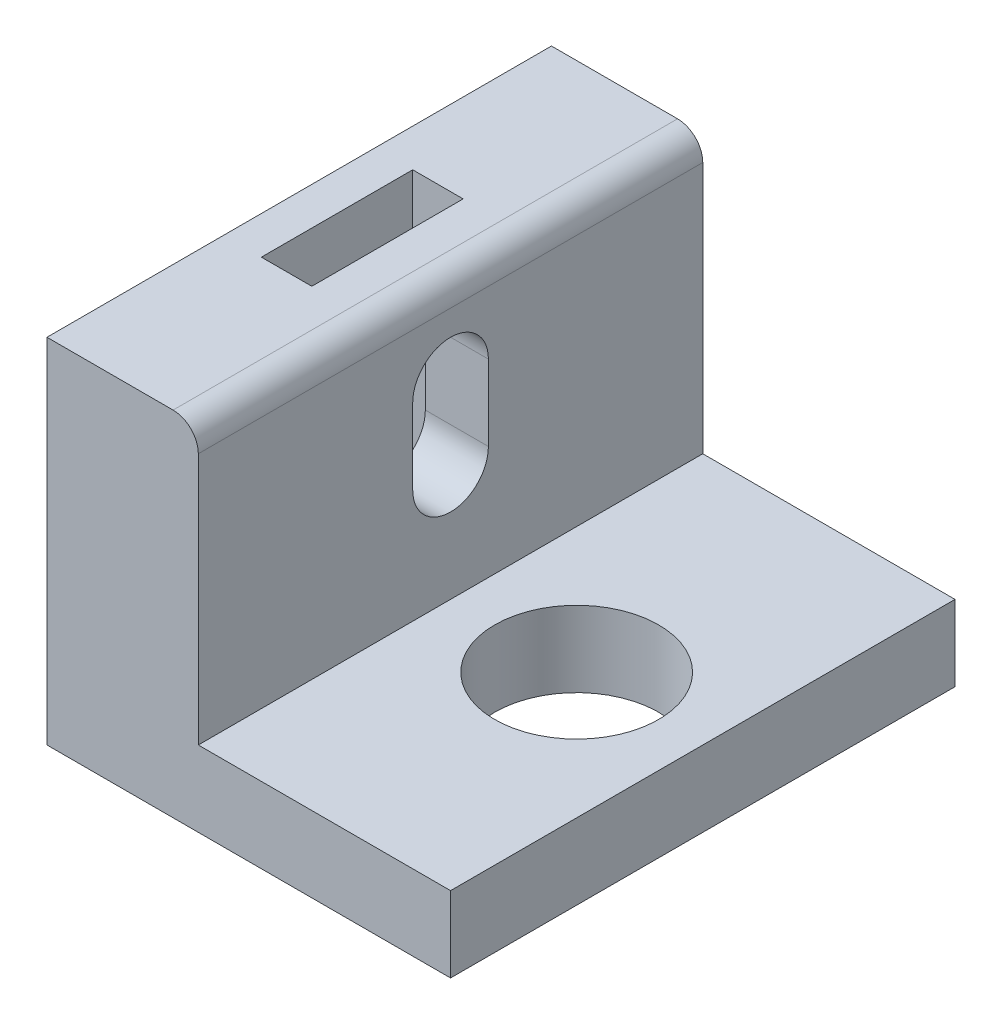
from build123d import *

# Parameters (mm, degrees)
ESTRUSIONE_ESTRUSIONE1_DEPTH         = 20
TAGLIO_ESTRUSIONE1_REACH             = 37.979
ESTRUSIONE_ESTRUSIONE4_DEPTH         = 0.6
SCHIZZO12_W                          = 2
SCHIZZO12_H                          = 6
TAGLIO_ESTRUSIONE2_DEPTH             = 11
SCHIZZO13_R                          = 3.25
TAGLIO_ESTRUSIONE3_DEPTH             = 27.487921942
TAGLIO_ESTRUSIONE4_REACH             = 34.76
SCHIZZO14_W                          = 18.5
SCHIZZO14_H                          = 9.5
TAGLIO_ESTRUSIONE4_DIRECTION_2_REACH = 34.76
SCHIZZO15_W                          = 1
SCHIZZO15_H                          = 20
ESTRUSIONE_ESTRUSIONE5_DEPTH         = 3


with BuildPart() as part:
    # Schizzo2 → Estrusione-Estrusione1 (new body)
    with BuildSketch(Plane.XY):
        with BuildLine():
            Line((-4, 9.5), (-11, 9.5))
            Line((-11, 9.5), (-11, 23.5))
            Line((-11, 23.5), (-6, 23.5))
            ThreePointArc((-6, 23.5), (-5.292893219, 23.207106781), (-5, 22.5))
            Line((-5, 22.5), (-5, 12.5))
            Line((-5, 12.5), (4, 12.5))
            Line((4, 12.5), (4, 9.5))
            Line((4, 9.5), (4, 6.5))
            Line((4, 6.5), (7.5, 6.5))
            Line((7.5, 6.5), (7.5, 4))
            Line((7.5, 4), (4, 0))
            Line((4, 0), (-4, 0))
            Line((-4, 0), (-7.5, 4))
            Line((-7.5, 4), (-7.5, 6.5))
            Line((-7.5, 6.5), (-4, 6.5))
            Line((-4, 6.5), (-4, 9.5))
        make_face()
    extrude(amount=-ESTRUSIONE_ESTRUSIONE1_DEPTH)

    # Schizzo6 → Taglio-Estrusione1 (cut, up to next)
    with BuildSketch(Plane.ZY.offset(11), mode=Mode.PRIVATE) as taglio_estrusione1_sk1:
        with BuildLine():
            Line((-8.5, 20), (-8.5, 17))
            ThreePointArc((-8.5, 17), (-10, 15.5), (-11.5, 17))
            Line((-11.5, 17), (-11.5, 20))
            ThreePointArc((-11.5, 20), (-10, 21.5), (-8.5, 20))
        make_face()
    taglio_estrusione1_tool1 = extrude(taglio_estrusione1_sk1.sketch, amount=-TAGLIO_ESTRUSIONE1_REACH, mode=Mode.PRIVATE) & part.part
    add(taglio_estrusione1_tool1.solids().sort_by_distance((-11, 18.5, -10))[0], mode=Mode.SUBTRACT)

    # Schizzo11 → Estrusione-Estrusione4 (add)
    with BuildSketch(Plane(origin=(0, 0, -20), x_dir=(-1, 0, 0), z_dir=(0, 0, -1))):
        with BuildLine():
            Line((-1.916666667, 6), (-2.5, 6))
            add(Edge.make_bspline(
                [(-2.5, 6), (-2.484196549, 6.065431756), (-2.453302094, 6.193345487), (-2.388863743, 6.376101829), (-2.318665127, 6.549045511), (-2.234371075, 6.708938219), (-2.142426246, 6.858993324), (-2.037084049, 6.995807413), (-1.923204564, 7.122860063), (-1.797243944, 7.235613218), (-1.665147858, 7.337714716), (-1.525054993, 7.424768393), (-1.379783905, 7.499656106), (-1.228328086, 7.561350822), (-1.070236625, 7.607826795), (-0.906938753, 7.641546577), (-0.738006538, 7.66344436), (-0.623332441, 7.665581492), (-0.565104167, 7.666666667)],
                knots=[0, 0, 0, 0, 1.162005537, 2.271625781, 3.343758855, 4.383309926, 5.390229558, 6.379919256, 7.361854164, 8.333198761, 9.295911338, 10.242430842, 11.177959212, 12.116337295, 13.062827104, 14.020064771, 14.994644689, 16, 16, 16, 16], degree=3))
            add(Edge.make_bspline(
                [(-0.565104167, 7.666666667), (-0.480264789, 7.664105239), (-0.312436625, 7.659038256), (-0.065876681, 7.612768588), (0.171887412, 7.539550485), (0.398253158, 7.438384992), (0.608515961, 7.313608553), (0.795597451, 7.165102613), (0.956961828, 6.995732482), (1.092337101, 6.80865772), (1.198333527, 6.608726059), (1.276493935, 6.402954339), (1.324077057, 6.191830678), (1.330243806, 6.049281445), (1.333333333, 5.977864583)],
                knots=[0, 0, 0, 0, 1.083050992, 2.142477498, 3.193116406, 4.255571735, 5.30263384, 6.308962982, 7.297363603, 8.282367274, 9.249857812, 10.179914175, 11.08814088, 12, 12, 12, 12], degree=3))
            add(Edge.make_bspline(
                [(1.333333333, 5.977864583), (1.331172379, 5.909137679), (1.326943725, 5.774649792), (1.291038272, 5.578309869), (1.230613784, 5.393261183), (1.146912796, 5.218724739), (1.038564203, 5.055807179), (0.907314909, 4.904141953), (0.752238537, 4.763056374), (0.634720509, 4.682234495), (0.57421875, 4.640625)],
                knots=[0, 0, 0, 0, 1.024540389, 2.004866551, 2.965041327, 3.920577974, 4.882998113, 5.874504559, 6.905732034, 8, 8, 8, 8], degree=3))
            add(Edge.make_bspline(
                [(0.57421875, 4.640625), (0.643363437, 4.607236967), (0.780359061, 4.541085617), (0.967095758, 4.411353496), (1.136611813, 4.261563137), (1.231147291, 4.144669639), (1.278645833, 4.0859375)],
                knots=[0, 0, 0, 0, 1.015518401, 2.012035669, 3.001164323, 4, 4, 4, 4], degree=3))
            add(Edge.make_bspline(
                [(1.278645833, 4.0859375), (1.309922612, 4.043115961), (1.37196399, 3.958174116), (1.448544267, 3.821606468), (1.518018337, 3.683525131), (1.572154458, 3.540229091), (1.614077354, 3.393379209), (1.644044271, 3.24272333), (1.662660533, 3.088138431), (1.665326558, 2.983558111), (1.666666667, 2.930989583)],
                knots=[0, 0, 0, 0, 1.025084078, 2.033381695, 3.024893161, 4.013698104, 4.991890475, 5.976764909, 6.982997093, 8, 8, 8, 8], degree=3))
            add(Edge.make_bspline(
                [(1.666666667, 2.930989583), (1.663333999, 2.83997153), (1.656684346, 2.658363755), (1.597248208, 2.390053558), (1.505109333, 2.127777625), (1.374260737, 1.876924352), (1.214792507, 1.64221793), (1.025071762, 1.43221907), (0.807254146, 1.251707377), (0.56432937, 1.100888382), (0.301140417, 0.980326526), (0.019642889, 0.896648418), (-0.276107211, 0.842148704), (-0.478920764, 0.836304519), (-0.58203125, 0.833333333)],
                knots=[0, 0, 0, 0, 0.955779014, 1.907060117, 2.875433937, 3.871313158, 4.872415639, 5.851225146, 6.836215519, 7.83643374, 8.849228613, 9.86973379, 10.916971861, 12, 12, 12, 12], degree=3))
            add(Edge.make_bspline(
                [(-0.58203125, 0.833333333), (-0.651524236, 0.834945729), (-0.78826326, 0.838118387), (-0.9892869, 0.859807218), (-1.181170056, 0.899420085), (-1.364172166, 0.952726223), (-1.538455805, 1.020310887), (-1.703489143, 1.104474184), (-1.860287517, 1.203481259), (-2.007371283, 1.318500779), (-2.144722909, 1.447166124), (-2.268692254, 1.591761428), (-2.381346155, 1.74961375), (-2.479668199, 1.922556569), (-2.568136825, 2.108354904), (-2.640901459, 2.309387829), (-2.704946086, 2.523858156), (-2.73472252, 2.673316816), (-2.75, 2.75)],
                knots=[0, 0, 0, 0, 1.048658725, 2.063410685, 3.046034179, 4.001477787, 4.936774919, 5.862367409, 6.792675028, 7.730719943, 8.675894397, 9.627829632, 10.600096036, 11.597688215, 12.626045268, 13.701542398, 14.82072376, 16, 16, 16, 16], degree=3))
            Line((-2.75, 2.75), (-2.166666667, 2.75))
            add(Edge.make_bspline(
                [(-2.166666667, 2.75), (-2.151469125, 2.699951833), (-2.121908588, 2.602603799), (-2.071590606, 2.462500375), (-2.014263815, 2.33406399), (-1.952765349, 2.216352478), (-1.888176806, 2.108206588), (-1.815906231, 2.012485974), (-1.74130639, 1.924986312), (-1.685073305, 1.875689176), (-1.657552083, 1.8515625)],
                knots=[0, 0, 0, 0, 1.198163088, 2.33053128, 3.407730985, 4.417276592, 5.372219308, 6.28897303, 7.162600585, 8, 8, 8, 8], degree=3))
            add(Edge.make_bspline(
                [(-1.657552083, 1.8515625), (-1.621158441, 1.823504166), (-1.548483496, 1.767474107), (-1.430056781, 1.695971082), (-1.305507707, 1.634014892), (-1.172137598, 1.586688029), (-1.032824452, 1.54661523), (-0.885316488, 1.520391409), (-0.730915085, 1.502399091), (-0.625489239, 1.500811361), (-0.571614583, 1.5)],
                knots=[0, 0, 0, 0, 0.946170439, 1.889420265, 2.845303464, 3.807233317, 4.801018734, 5.828864929, 6.890507805, 8, 8, 8, 8], degree=3))
            add(Edge.make_bspline(
                [(-0.571614583, 1.5), (-0.51078665, 1.501143824), (-0.391842877, 1.503380473), (-0.218283853, 1.523949643), (-0.053170021, 1.553906125), (0.101665412, 1.600173093), (0.24825064, 1.657337532), (0.384530847, 1.729113142), (0.512295044, 1.813324768), (0.629906797, 1.909040348), (0.735662739, 2.013823125), (0.828778978, 2.123418828), (0.907939064, 2.237365369), (0.97179428, 2.356293307), (1.022216731, 2.479710161), (1.056542675, 2.607962273), (1.080409774, 2.740000053), (1.082353483, 2.829753852), (1.083333333, 2.875)],
                knots=[0, 0, 0, 0, 1.217147791, 2.380027433, 3.494444702, 4.572153297, 5.609568379, 6.639424714, 7.649109417, 8.668170816, 9.669597737, 10.625200337, 11.543417969, 12.441394052, 13.322311151, 14.205496177, 15.095365482, 16, 16, 16, 16], degree=3))
            add(Edge.make_bspline(
                [(1.083333333, 2.875), (1.080491345, 2.935563915), (1.074821509, 3.056390388), (1.031534147, 3.234151597), (0.960333399, 3.405423649), (0.860655878, 3.567284402), (0.739318097, 3.71729679), (0.597497555, 3.851143829), (0.43401656, 3.961588284), (0.283551089, 4.037895789), (0.150272941, 4.089964642), (0.036215798, 4.124646719), (-0.091475036, 4.154014937), (-0.231255399, 4.181337727), (-0.384178515, 4.204591659), (-0.5500779, 4.223983603), (-0.728987171, 4.239500107), (-0.852842194, 4.246429284), (-0.916666667, 4.25)],
                knots=[0, 0, 0, 0, 1.07054697, 2.135767047, 3.216561865, 4.33974944, 5.486079747, 6.621378074, 7.775625952, 8.963672916, 9.598146892, 10.304877434, 11.070270905, 11.915000392, 12.823868403, 13.805723172, 14.86925407, 16, 16, 16, 16], degree=3))
            Line((-0.916666667, 4.25), (-0.916666667, 4.916666667))
            add(Edge.make_bspline(
                [(-0.916666667, 4.916666667), (-0.836250216, 4.918031302), (-0.678734144, 4.920704288), (-0.448644721, 4.95303345), (-0.228622855, 4.997754616), (-0.02354462, 5.066255688), (0.163374419, 5.145816239), (0.325539394, 5.238398914), (0.460678382, 5.34131202), (0.568134658, 5.456144008), (0.648974654, 5.579300525), (0.708081563, 5.707660032), (0.742996455, 5.842347574), (0.747657265, 5.934266243), (0.75, 5.98046875)],
                knots=[0, 0, 0, 0, 1.321986639, 2.589447074, 3.816329219, 5.01088745, 6.139805852, 7.153945165, 8.075214402, 8.924034688, 9.728124013, 10.488707548, 11.240355623, 12, 12, 12, 12], degree=3))
            add(Edge.make_bspline(
                [(0.75, 5.98046875), (0.74923038, 6.014413134), (0.747699256, 6.081943876), (0.728390026, 6.180604717), (0.69937395, 6.276249331), (0.659483024, 6.368470979), (0.606089798, 6.456630059), (0.542192966, 6.541478178), (0.466109351, 6.622530911), (0.37892495, 6.698080076), (0.285303026, 6.770080088), (0.182696301, 6.831205413), (0.074198534, 6.883474814), (-0.040310397, 6.926578176), (-0.161202096, 6.959002568), (-0.28790856, 6.982283416), (-0.420671401, 6.996839061), (-0.511247475, 6.99893469), (-0.557291667, 7)],
                knots=[0, 0, 0, 0, 0.884392785, 1.759457502, 2.611959086, 3.489218968, 4.37281399, 5.2945488, 6.255912374, 7.266815255, 8.301784654, 9.332968512, 10.37626691, 11.440494194, 12.520033166, 13.637162961, 14.798855837, 16, 16, 16, 16], degree=3))
            add(Edge.make_bspline(
                [(-0.557291667, 7), (-0.631301907, 6.997416042), (-0.775861121, 6.992368971), (-0.984260252, 6.948163375), (-1.177996158, 6.877632648), (-1.326082253, 6.793442755), (-1.435435605, 6.710334806), (-1.51357849, 6.637753232), (-1.590316581, 6.557092273), (-1.660601409, 6.463383862), (-1.731681652, 6.362974109), (-1.79639298, 6.2507587), (-1.859275266, 6.129664825), (-1.897165715, 6.044058647), (-1.916666667, 6)],
                knots=[0, 0, 0, 0, 1.472543308, 2.876219568, 4.221790263, 5.565193594, 6.249813518, 6.953379497, 7.687249741, 8.463570142, 9.283606569, 10.136032583, 11.040678096, 12, 12, 12, 12], degree=3))
        make_face()
    extrude(amount=ESTRUSIONE_ESTRUSIONE4_DEPTH)

    # Schizzo12 → Taglio-Estrusione2 (cut)
    with BuildSketch(Plane(origin=(0, 23.5, 0), x_dir=(1, 0, 0), z_dir=(0, 1, 0))):
        with Locations((-8.5, 10)):
            Rectangle(SCHIZZO12_W, SCHIZZO12_H)
    extrude(amount=-TAGLIO_ESTRUSIONE2_DEPTH, mode=Mode.SUBTRACT)

    # Schizzo13 → Taglio-Estrusione3 (cut, through all)
    with BuildSketch(Plane(origin=(0, 12.5, 0), x_dir=(1, 0, 0), z_dir=(0, 1, 0))):
        with Locations(Location((0, 10, 0), (0, 0, 180))):
            Circle(SCHIZZO13_R)
    extrude(amount=-TAGLIO_ESTRUSIONE3_DEPTH, mode=Mode.SUBTRACT)

    # Schizzo14 → Taglio-Estrusione4 (cut, up to next)
    with BuildSketch(Plane(origin=(0, 0, -20), x_dir=(-1, 0, 0), z_dir=(0, 0, -1)), mode=Mode.PRIVATE) as taglio_estrusione4_sk1:
        with Locations((1.75, 4.75)):
            Rectangle(SCHIZZO14_W, SCHIZZO14_H)
    taglio_estrusione4_tool1 = extrude(taglio_estrusione4_sk1.sketch, amount=-TAGLIO_ESTRUSIONE4_REACH, mode=Mode.PRIVATE) & part.part
    add(taglio_estrusione4_tool1.solids().sort_by_distance((-1.75, 4.75, -20))[0], mode=Mode.SUBTRACT)

    # Schizzo14 → Taglio-Estrusione4 direction 2 (cut, up to next)
    with BuildSketch(Plane(origin=(0, 0, -20), x_dir=(-1, 0, 0), z_dir=(0, 0, -1)), mode=Mode.PRIVATE) as taglio_estrusione4_direction_2_sk1:
        with Locations((1.75, 4.75)):
            Rectangle(SCHIZZO14_W, SCHIZZO14_H)
    taglio_estrusione4_direction_2_tool1 = extrude(taglio_estrusione4_direction_2_sk1.sketch, amount=TAGLIO_ESTRUSIONE4_DIRECTION_2_REACH, mode=Mode.PRIVATE) & part.part
    add(taglio_estrusione4_direction_2_tool1.solids().sort_by_distance((-1.75, 4.75, -20))[0], mode=Mode.SUBTRACT)

    # Schizzo15 → Estrusione-Estrusione5 (add, through all)
    with BuildSketch(Plane(origin=(0, 12.5, 0), x_dir=(1, 0, 0), z_dir=(0, 1, 0))):
        with Locations((4.5, 10)):
            Rectangle(SCHIZZO15_W, SCHIZZO15_H)
    extrude(amount=-ESTRUSIONE_ESTRUSIONE5_DEPTH)


solid = part.part
